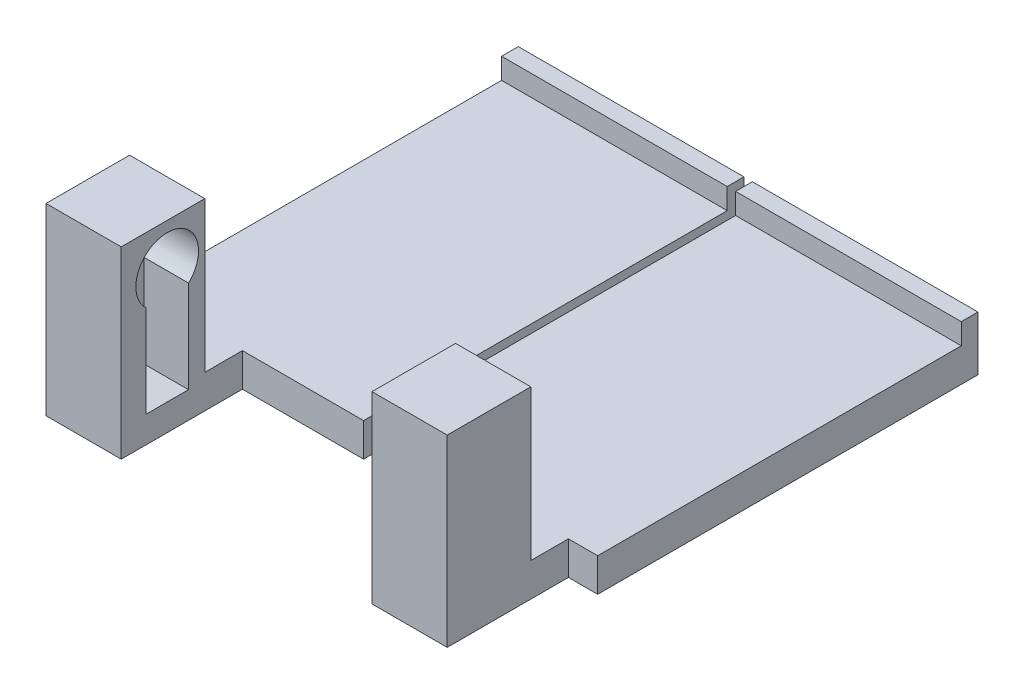
from build123d import *

# Parameters (mm, degrees)
SKETCH1_W                = 10
SKETCH1_H                = 18
BOSS_EXTRUDE1_DEPTH      = 9
SKETCH1_15_R             = 3.75
SKETCH1_15_W             = 5.1
SKETCH1_15_H             = 13.8
CUT_EXTRUDE1_DEPTH       = 5.3
BOSS_EXTRUDE2_DEPTH      = 12.5
BOSS_EXTRUDE2_DEPTH_BACK = 14.5
SKETCH1_18_W             = 45.5
SKETCH1_18_H             = 4
SKETCH5_W                = 27
SKETCH5_H                = 2
BOSS_EXTRUDE3_DEPTH      = 2.5


with BuildPart() as part:
    # Sketch1 → Boss-Extrude1 (new body)
    with BuildSketch(Plane(origin=(0, 0, 0), x_dir=(0, 0, -1), z_dir=(1, 0, 0))):
        with Locations((1.5, -3.978289551)):
            Rectangle(SKETCH1_W, SKETCH1_H)
        Polygon((6.5, -12.978289551), (-3.5, -12.978289551), (-3.5, -16.978289551), (11, -16.978289551), (11, -12.978289551), align=None)
    extrude(amount=BOSS_EXTRUDE1_DEPTH)

    # Sketch1<15> → Cut-Extrude1 (cut)
    with BuildSketch(Plane(origin=(0, 0, 0), x_dir=(0, 0, -1), z_dir=(1, 0, 0))):
        with Locations((2, 0)):
            Circle(SKETCH1_15_R)
        with Locations((2, -6.9)):
            Rectangle(SKETCH1_15_W, SKETCH1_15_H)
    extrude(amount=CUT_EXTRUDE1_DEPTH, mode=Mode.SUBTRACT)

    # Sketch1<18> → Boss-Extrude2 (add, two sides: drawn at the far end of the back side and taken through both)
    with BuildSketch(Plane(origin=(0, 0, 0), x_dir=(0, 0, -1), z_dir=(1, 0, 0)).offset(-BOSS_EXTRUDE2_DEPTH_BACK)):
        with Locations((33.75, -14.978289551)):
            Rectangle(SKETCH1_18_W, SKETCH1_18_H)
    extrude(amount=BOSS_EXTRUDE2_DEPTH + BOSS_EXTRUDE2_DEPTH_BACK)

    # Sketch5 → Boss-Extrude3 (add)
    with BuildSketch(Plane(origin=(0, -12.978289551, 0), x_dir=(1, 0, 0), z_dir=(0, 1, 0))):
        with Locations((-1, 55.5)):
            Rectangle(SKETCH5_W, SKETCH5_H)
    extrude(amount=BOSS_EXTRUDE3_DEPTH)


with BuildPart() as body_2:
    # Mirror3: mirrored copy
    add(part.part.mirror(Plane(origin=(-15, 0, 0), x_dir=(0, 0, 1), z_dir=(1, 0, 0))))


solid = Compound([part.part, body_2.part])
